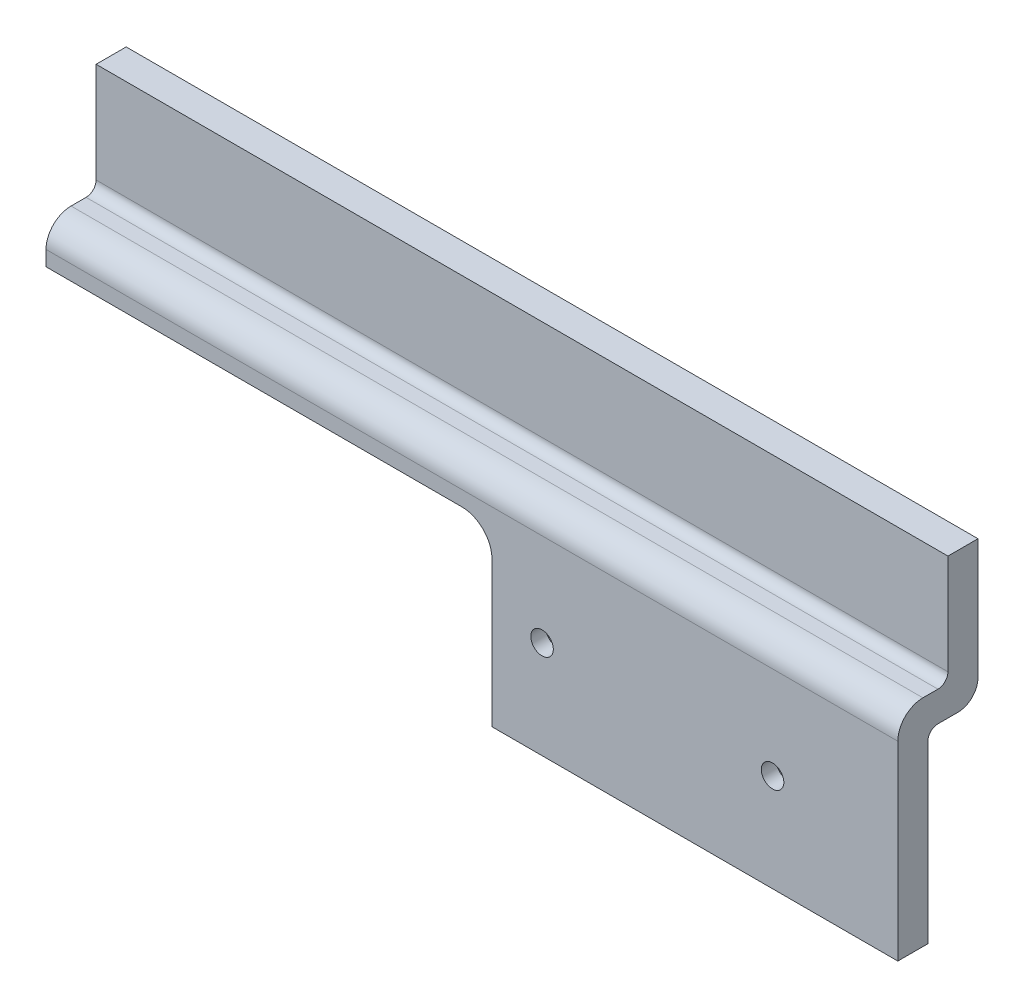
from build123d import *

# Parameters (mm, degrees)
ESTRUSIONE_ESTRUSIONE1_DEPTH                         = 170
FORO_LAMATO_PER_BULLONE_M5_A_TESTA_ESAGO_D           = 4.5
FORO_LAMATO_PER_BULLONE_M5_A_TESTA_ESAGO_DEPTH       = 30
FORO_LAMATO_PER_BULLONE_M5_A_TESTA_ESAGO_CBORE_D     = 10
FORO_LAMATO_PER_BULLONE_M5_A_TESTA_ESAGO_CBORE_DEPTH = 3
FORO_LAMATO_PER_BULLONE_M5_A_TESTA_ESAGO_TIP         = 1.351936393
SCHIZZO5_W                                           = 89
SCHIZZO5_H                                           = 35
TAGLIO_ESTRUSIONE1_DEPTH                             = 100
RACCORDO1_R                                          = 6


with BuildPart() as part:
    # Schizzo1 → Estrusione-Estrusione1 (new body)
    with BuildSketch(Plane(origin=(0, 0, 0), x_dir=(0, 0, -1), z_dir=(1, 0, 0))):
        with BuildLine():
            Line((-6, 0), (0, 0))
            Line((0, 0), (0, 35))
            ThreePointArc((0, 35), (0.585786438, 36.414213562), (2, 37))
            Line((2, 37), (6, 37))
            ThreePointArc((6, 37), (8.828427125, 38.171572875), (10, 41))
            Line((10, 41), (10, 65))
            Line((10, 65), (4, 65))
            Line((4, 65), (4, 45))
            ThreePointArc((4, 45), (3.414213562, 43.585786438), (2, 43))
            Line((2, 43), (-1, 43))
            ThreePointArc((-1, 43), (-4.535533906, 41.535533906), (-6, 38))
            Line((-6, 38), (-6, 0))
        make_face()
    extrude(amount=ESTRUSIONE_ESTRUSIONE1_DEPTH)

    # Foro lamato per Bullone M5 a testa esagonale-2
    with Locations(Plane(origin=(0, 0, 0), x_dir=(-1, 0, 0), z_dir=(0, 0, -1))):
        with Locations((-145, 19.5), (-99, 19.5)):
            CounterBoreHole(FORO_LAMATO_PER_BULLONE_M5_A_TESTA_ESAGO_D / 2, FORO_LAMATO_PER_BULLONE_M5_A_TESTA_ESAGO_CBORE_D / 2, FORO_LAMATO_PER_BULLONE_M5_A_TESTA_ESAGO_CBORE_DEPTH, depth=FORO_LAMATO_PER_BULLONE_M5_A_TESTA_ESAGO_DEPTH)
            with Locations((0, 0, -(FORO_LAMATO_PER_BULLONE_M5_A_TESTA_ESAGO_DEPTH + FORO_LAMATO_PER_BULLONE_M5_A_TESTA_ESAGO_TIP / 2))):  # 118° drill point
                Cone(0, FORO_LAMATO_PER_BULLONE_M5_A_TESTA_ESAGO_D / 2, FORO_LAMATO_PER_BULLONE_M5_A_TESTA_ESAGO_TIP, mode=Mode.SUBTRACT)

    # Schizzo5 → Taglio-Estrusione1 (cut)
    with BuildSketch(Plane(origin=(0, 0, 0), x_dir=(-1, 0, 0), z_dir=(0, 0, -1))):
        with Locations((-44.5, 17.5)):
            Rectangle(SCHIZZO5_W, SCHIZZO5_H)
    extrude(amount=-TAGLIO_ESTRUSIONE1_DEPTH, mode=Mode.SUBTRACT)

    # Raccordo1
    raccordo1_edges = [part.edges().sort_by_distance(p)[0] for p in [
        (89, 35, 3),
    ]]
    fillet(raccordo1_edges, radius=RACCORDO1_R)


solid = part.part
